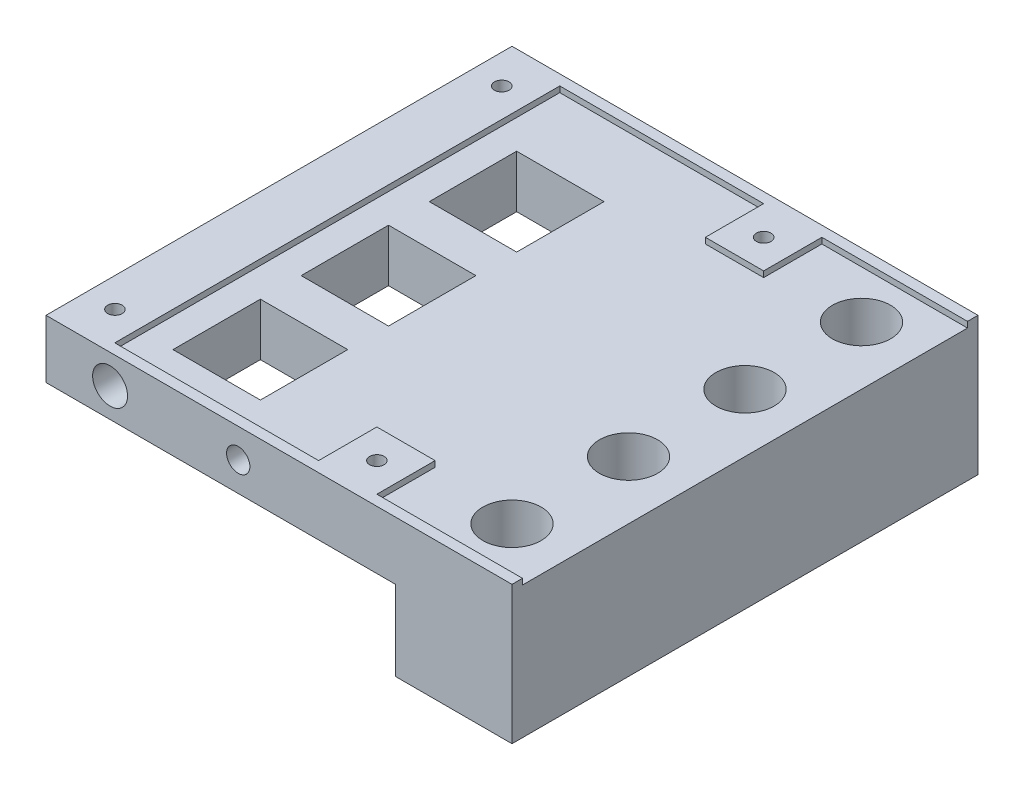
from build123d import *

# Parameters (mm, degrees)
SKETCH1_W                                     = 80
SKETCH1_H                                     = 80
BOSS_EXTRUDE1_DEPTH                           = 23.7
CUT_EXTRUDE1_DEPTH                            = 1
SKETCH3_W                                     = 15
SKETCH3_H                                     = 15
CUT_EXTRUDE2_DEPTH                            = 95.785112281
SKETCH4_W                                     = 60
SKETCH4_H                                     = 13.7
CUT_EXTRUDE3_DEPTH                            = 114.918214427
SKETCH5_R                                     = 3
SKETCH5_R_2                                   = 2
CUT_EXTRUDE4_DEPTH                            = 114.918214427
CBORE_FOR_M5_HEX_SOCKET_HEAD_CAP1_D           = 5.5
CBORE_FOR_M5_HEX_SOCKET_HEAD_CAP1_CBORE_D     = 10
CBORE_FOR_M5_HEX_SOCKET_HEAD_CAP1_CBORE_DEPTH = 15
M3X0_5_TAPPED_HOLE1_D                         = 2.5
M2X0_4_TAPPED_HOLE1_REACH                     = 95.041
M2X0_4_TAPPED_HOLE1_BORE_R                    = 0.8


with BuildPart() as part:
    # Sketch1 → Boss-Extrude1 (new body)
    with BuildSketch(Plane(origin=(0, 0, 0), x_dir=(1, 0, 0), z_dir=(0, 1, 0))):
        with Locations((-37.560747664, 9.530373832)):
            Rectangle(SKETCH1_W, SKETCH1_H)
    extrude(amount=BOSS_EXTRUDE1_DEPTH)

    # Sketch2 → Cut-Extrude1 (cut)
    with BuildSketch(Plane(origin=(0, 23.7, 0), x_dir=(1, 0, 0), z_dir=(0, 1, 0))):
        Polygon((2.439252336, -28.669626168), (-22.560747664, -28.669626168), (-22.560747664, -18.669626168), (-32.560747664, -18.669626168), (-32.560747664, -28.669626168), (-67.560747664, -28.669626168), (-67.560747664, 47.730373832), (-32.560747664, 47.730373832), (-32.560747664, 37.730373832), (-22.560747664, 37.730373832), (-22.560747664, 47.730373832), (2.439252336, 47.730373832), align=None)
    extrude(amount=-CUT_EXTRUDE1_DEPTH, mode=Mode.SUBTRACT)

    # Sketch3 → Cut-Extrude2 (cut, through all)
    with BuildSketch(Plane(origin=(0, 22.7, 0), x_dir=(1, 0, 0), z_dir=(0, 1, 0))):
        with Locations((-55.060747664, -16.169626168)):
            Rectangle(SKETCH3_W, SKETCH3_H)
        with Locations((-55.060747664, 5.830373832)):
            Rectangle(SKETCH3_W, SKETCH3_H)
        with Locations((-55.060747664, 27.830373832)):
            Rectangle(SKETCH3_W, SKETCH3_H)
    extrude(amount=-CUT_EXTRUDE2_DEPTH, mode=Mode.SUBTRACT)

    # Sketch4 → Cut-Extrude3 (cut, through all)
    with BuildSketch(Plane.XY.offset(30.469626168)):
        with Locations((-47.560747664, 6.85)):
            Rectangle(SKETCH4_W, SKETCH4_H)
    extrude(amount=-CUT_EXTRUDE3_DEPTH, mode=Mode.SUBTRACT)

    # Sketch5 → Cut-Extrude4 (cut, through all)
    with BuildSketch(Plane.XY.offset(30.469626168)):
        with Locations((-66.560747664, 18.7)):
            Circle(SKETCH5_R)
        with Locations((-44.560747664, 18.7)):
            Circle(SKETCH5_R_2)
    extrude(amount=-CUT_EXTRUDE4_DEPTH, mode=Mode.SUBTRACT)

    # CBORE for M5 Hex Socket Head Cap1 (through all)
    with Locations(Plane(origin=(0, 22.7, 0), x_dir=(1, 0, 0), z_dir=(0, 1, 0))):
        with Locations((-7.560747664, -20.469626168), (-7.560747664, -0.469626168), (-7.560747664, 19.530373832), (-7.560747664, 39.530373832)):
            CounterBoreHole(CBORE_FOR_M5_HEX_SOCKET_HEAD_CAP1_D / 2, CBORE_FOR_M5_HEX_SOCKET_HEAD_CAP1_CBORE_D / 2, CBORE_FOR_M5_HEX_SOCKET_HEAD_CAP1_CBORE_DEPTH)

    # M3x0.5 Tapped Hole1 (through all)
    with Locations(Plane(origin=(0, 23.7, 0), x_dir=(1, 0, 0), z_dir=(0, 1, 0))):
        with Locations((-27.560747664, -23.669626168), (-27.560747664, 42.730373832), (-72.523263375, -23.669626168), (-72.523263375, 42.730373832)):
            Hole(M3X0_5_TAPPED_HOLE1_D / 2)

    # M2x0.4 Tapped Hole1 bore → M2x0.4 Tapped Hole1 (cut, up to next)
    with BuildSketch(Plane(origin=(0, 13.7, 0), x_dir=(-1, 0, 0), z_dir=(0, -1, 0)), mode=Mode.PRIVATE) as m2x0_4_tapped_hole1_sk1:
        with Locations((66.560747664, -15.469626168)):
            Circle(M2X0_4_TAPPED_HOLE1_BORE_R)
    m2x0_4_tapped_hole1_tool1 = extrude(m2x0_4_tapped_hole1_sk1.sketch, amount=-M2X0_4_TAPPED_HOLE1_REACH, mode=Mode.PRIVATE) & part.part
    # M2x0.4 Tapped Hole1 bore → M2x0.4 Tapped Hole1 (cut, up to next)
    with BuildSketch(Plane(origin=(0, 13.7, 0), x_dir=(-1, 0, 0), z_dir=(0, -1, 0)), mode=Mode.PRIVATE) as m2x0_4_tapped_hole1_sk2:
        with Locations((44.560747664, -15.469626168)):
            Circle(M2X0_4_TAPPED_HOLE1_BORE_R)
    m2x0_4_tapped_hole1_tool2 = extrude(m2x0_4_tapped_hole1_sk2.sketch, amount=-M2X0_4_TAPPED_HOLE1_REACH, mode=Mode.PRIVATE) & part.part
    # M2x0.4 Tapped Hole1 bore → M2x0.4 Tapped Hole1 (cut, up to next)
    with BuildSketch(Plane(origin=(0, 13.7, 0), x_dir=(-1, 0, 0), z_dir=(0, -1, 0)), mode=Mode.PRIVATE) as m2x0_4_tapped_hole1_sk3:
        with Locations((66.560747664, 34.530373832)):
            Circle(M2X0_4_TAPPED_HOLE1_BORE_R)
    m2x0_4_tapped_hole1_tool3 = extrude(m2x0_4_tapped_hole1_sk3.sketch, amount=-M2X0_4_TAPPED_HOLE1_REACH, mode=Mode.PRIVATE) & part.part
    # M2x0.4 Tapped Hole1 bore → M2x0.4 Tapped Hole1 (cut, up to next)
    with BuildSketch(Plane(origin=(0, 13.7, 0), x_dir=(-1, 0, 0), z_dir=(0, -1, 0)), mode=Mode.PRIVATE) as m2x0_4_tapped_hole1_sk4:
        with Locations((44.560747664, 34.530373832)):
            Circle(M2X0_4_TAPPED_HOLE1_BORE_R)
    m2x0_4_tapped_hole1_tool4 = extrude(m2x0_4_tapped_hole1_sk4.sketch, amount=-M2X0_4_TAPPED_HOLE1_REACH, mode=Mode.PRIVATE) & part.part
    add(m2x0_4_tapped_hole1_tool1.solids().sort_by_distance((-66.560748, 13.7, 15.469626))[0], mode=Mode.SUBTRACT)
    add(m2x0_4_tapped_hole1_tool2.solids().sort_by_distance((-44.560748, 13.7, 15.469626))[0], mode=Mode.SUBTRACT)
    add(m2x0_4_tapped_hole1_tool3.solids().sort_by_distance((-66.560748, 13.7, -34.530374))[0], mode=Mode.SUBTRACT)
    add(m2x0_4_tapped_hole1_tool4.solids().sort_by_distance((-44.560748, 13.7, -34.530374))[0], mode=Mode.SUBTRACT)


solid = part.part
